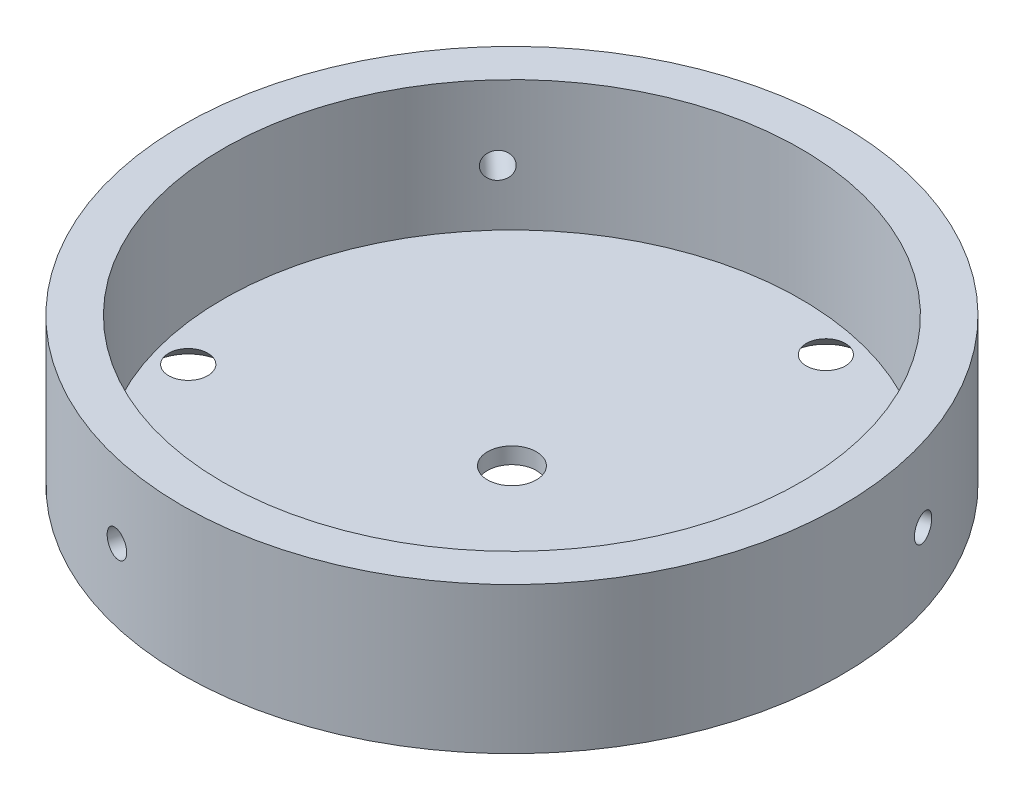
from build123d import *

# Parameters (mm, degrees)
SKETCH1_R           = 20.25
BOSS_EXTRUDE1_DEPTH = 9
SKETCH2_R           = 17.75
CUT_EXTRUDE1_DEPTH  = 8
CIRPATTERN1_COUNT   = 3
SKETCH5_R           = 1.5
CUT_EXTRUDE2_DEPTH  = 8
CIRPATTERN2_COUNT   = 3


with BuildPart() as part:
    # Sketch1 → Boss-Extrude1 (new body)
    with BuildSketch(Plane(origin=(0, 0, 0), x_dir=(1, 0, 0), z_dir=(0, 1, 0))):
        with Locations(Location((0, 0, 0), (0, 0, 270))):
            Circle(SKETCH1_R)
    extrude(amount=BOSS_EXTRUDE1_DEPTH)

    # Sketch2 → Cut-Extrude1 (cut)
    with BuildSketch(Plane(origin=(0, 9, 0), x_dir=(1, 0, 0), z_dir=(0, 1, 0))):
        with Locations(Location((0, 0, 0), (0, 0, 270))):
            Circle(SKETCH2_R)
    extrude(amount=-CUT_EXTRUDE1_DEPTH, mode=Mode.SUBTRACT)

    # Sketch4 → CSK SLOT for M2 Countersunk Flat Head Screw1 (revolve, cut)
    with BuildSketch(Plane(origin=(11.609715894, 0, 11.00974554), x_dir=(0, 0, -1), z_dir=(1, 0, 0))):
        Polygon((0, 0), (0, 6.521032743), (1.2, 5.8), (1.2, 1), (2.2, 0), align=None)
    csk_slot_for_m2_countersunk_flat_head_sc = revolve(axis=Axis((11.609715894, -6.35, 11.00974554), (0, 1, 0)), mode=Mode.SUBTRACT)

    # CirPattern1: CSK SLOT for M2 Countersunk Flat Head Screw1 ×3 about axis
    cirpattern1_axis = Axis((0, 0, 0), (0, 1, 0))
    for i in range(1, CIRPATTERN1_COUNT):
        add(csk_slot_for_m2_countersunk_flat_head_sc.rotate(cirpattern1_axis, i * 360 / CIRPATTERN1_COUNT), mode=Mode.SUBTRACT)

    # Sketch5 → Cut-Extrude2 (cut)
    with BuildSketch(Plane.XZ):
        with Locations(Location((0, 0, 0), (0, 0, 270))):
            Circle(SKETCH5_R)
    extrude(amount=-CUT_EXTRUDE2_DEPTH, mode=Mode.SUBTRACT)

    # Sketch6 → M2 Tapped Hole1 (revolve, cut)
    with BuildSketch(Plane(origin=(-4.560794248, 4.445790719, 19.729715047), x_dir=(0.974306915892993, 0, 0.22522440729877435), z_dir=(0, 1, 0))):
        Polygon((0, 0), (0, 4.980688495), (0.8, 4.5), (0.8, 0), align=None)
    m2_tapped_hole1 = revolve(axis=Axis((-5.990969234, 4.445790719, 25.916563963), (0.22522440729877433, 0, -0.9743069158929931)), mode=Mode.SUBTRACT)

    # CirPattern2: M2 Tapped Hole1 ×3 about axis
    cirpattern2_axis = Axis((0, 9, 0), (0, -1, 0))
    for i in range(1, CIRPATTERN2_COUNT):
        add(m2_tapped_hole1.rotate(cirpattern2_axis, i * 360 / CIRPATTERN2_COUNT), mode=Mode.SUBTRACT)


solid = part.part
